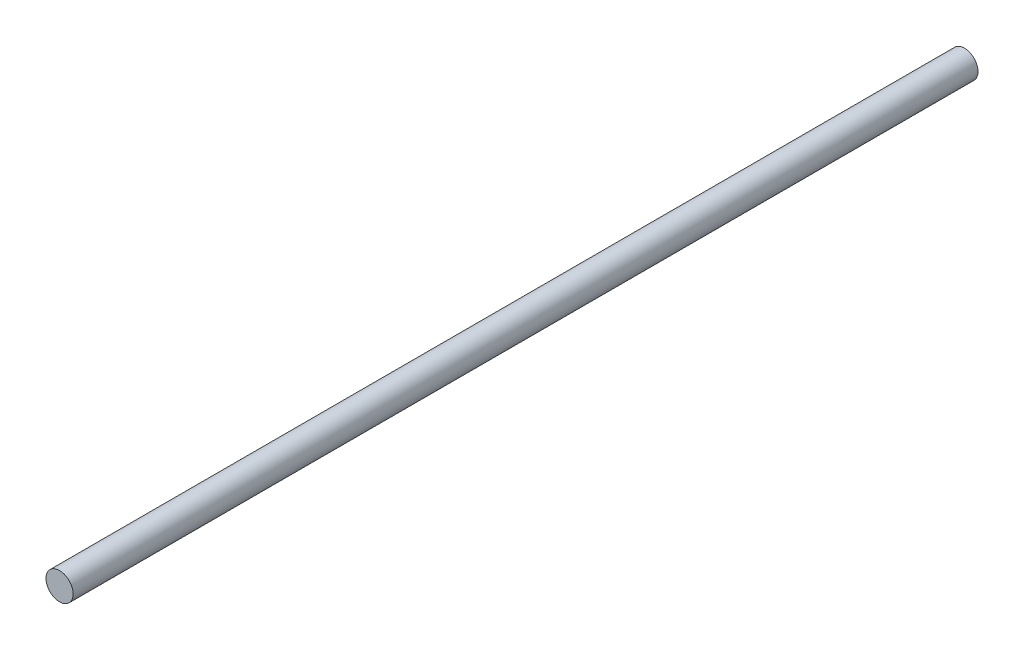
from build123d import *

# Parameters (mm, degrees)
SKETCH1_R           = 6
BOSS_EXTRUDE1_DEPTH = 200


with BuildPart() as part:
    # Sketch1 → Boss-Extrude1 (new, symmetric)
    with BuildSketch(Plane.XY):
        Circle(SKETCH1_R)
    extrude(amount=BOSS_EXTRUDE1_DEPTH, both=True)


solid = part.part
